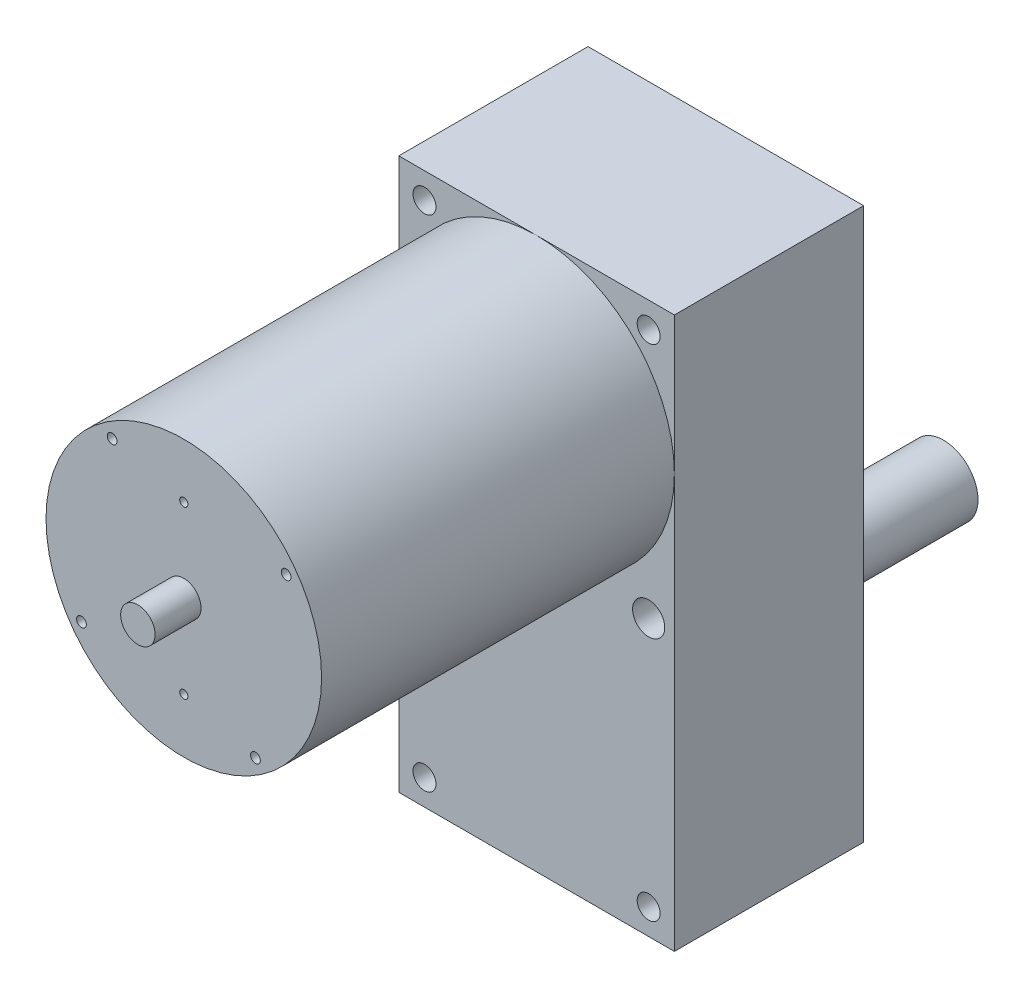
from build123d import *

# Parameters (mm, degrees)
SKETCH1_W                 = 76.2
SKETCH1_H                 = 152.4
SKETCH1_R                 = 3.175
SKETCH1_R_2               = 4.445
BOSS_EXTRUDE1_DEPTH       = 52.324
SKETCH1_3_R               = 23.495
SKETCH1_3_R_2             = 9.525
BOSS_EXTRUDE2_DEPTH       = 4.826
SKETCH1_5_R               = 9.525
SKETCH1_5_R_2             = 3.96875
BOSS_EXTRUDE3_DEPTH       = 60.198
CUT_EXTRUDE1_START        = -26.924
CUT_EXTRUDE1_DEPTH        = 26.924
SKETCH4_R                 = 38.1
BOSS_EXTRUDE4_DEPTH       = 97.536
SKETCH5_R                 = 4.7625
BOSS_EXTRUDE5_DEPTH       = 12.7
F_4_40_TAPPED_HOLE1_D     = 2.2606
F_4_40_TAPPED_HOLE1_DEPTH = 7.6
F_4_40_TAPPED_HOLE1_TIP   = 0.679152758
F_6_32_TAPPED_HOLE1_D     = 2.7051
F_6_32_TAPPED_HOLE1_DEPTH = 9.39
F_6_32_TAPPED_HOLE1_TIP   = 0.81269403


with BuildPart() as part:
    # Sketch1 → Boss-Extrude1 (new body)
    with BuildSketch(Plane.XY):
        Rectangle(SKETCH1_W, SKETCH1_H)
        with Locations((-30.994242086, -69.088)):
            Circle(SKETCH1_R, mode=Mode.SUBTRACT)
        with Locations((-30.988, 0)):
            Circle(SKETCH1_R_2, mode=Mode.SUBTRACT)
        with Locations((30.994242086, -69.088)):
            Circle(SKETCH1_R, mode=Mode.SUBTRACT)
        with Locations((30.988, 0)):
            Circle(SKETCH1_R_2, mode=Mode.SUBTRACT)
        with Locations((-30.988, 69.088)):
            Circle(SKETCH1_R, mode=Mode.SUBTRACT)
        with Locations((30.988, 69.088)):
            Circle(SKETCH1_R, mode=Mode.SUBTRACT)
    extrude(amount=BOSS_EXTRUDE1_DEPTH)

    # Sketch1<3> → Boss-Extrude2 (add)
    # profile 1 of 2: a face of its own
    with BuildSketch(Plane.XY):
        with Locations((0, 38.608)):
            Circle(SKETCH1_3_R)
    # profile 2 of 2: a face of its own
    with BuildSketch(Plane.XY):
        with Locations((0, -38.608)):
            Circle(SKETCH1_3_R)
        with Locations((0, -38.608)):
            Circle(SKETCH1_3_R_2, mode=Mode.SUBTRACT)
    extrude(amount=-BOSS_EXTRUDE2_DEPTH)

    # Sketch1<5> → Boss-Extrude3 (add)
    with BuildSketch(Plane.XY):
        with Locations((0, -38.608)):
            Circle(SKETCH1_5_R)
        with Locations((0, -38.608)):
            Circle(SKETCH1_5_R_2, mode=Mode.SUBTRACT)
    extrude(amount=-BOSS_EXTRUDE3_DEPTH)

    # Sketch2 → Cut-Extrude1 (cut)
    with BuildSketch(Plane(origin=(0, 0, -60.198), x_dir=(-1, 0, 0), z_dir=(0, 0, -1)).offset(CUT_EXTRUDE1_START)):
        with BuildLine():
            Line((8.980256121, -35.433), (4.427938354, -35.433))
            Line((4.427938354, -35.433), (4.427938354, -41.783))
            Line((4.427938354, -41.783), (8.980256121, -41.783))
            ThreePointArc((8.980256121, -41.783), (9.525, -38.608), (8.980256121, -35.433))
        make_face()
    extrude(amount=CUT_EXTRUDE1_DEPTH, mode=Mode.SUBTRACT)

    # Sketch4 → Boss-Extrude4 (add)
    with BuildSketch(Plane.XY.offset(52.324)):
        with Locations((0, 38.1)):
            Circle(SKETCH4_R)
    extrude(amount=BOSS_EXTRUDE4_DEPTH)

    # Sketch5 → Boss-Extrude5 (add)
    with BuildSketch(Plane.XY.offset(149.86)):
        with Locations((0, 38.1)):
            Circle(SKETCH5_R)
    extrude(amount=BOSS_EXTRUDE5_DEPTH)

    # #4-40 Tapped Hole1
    with Locations(Plane.XY.offset(149.86)):
        with Locations((0, 61.1), (0, 15.1)):
            Hole(F_4_40_TAPPED_HOLE1_D / 2, depth=F_4_40_TAPPED_HOLE1_DEPTH)
            with Locations((0, 0, -(F_4_40_TAPPED_HOLE1_DEPTH + F_4_40_TAPPED_HOLE1_TIP / 2))):  # 118° drill point
                Cone(0, F_4_40_TAPPED_HOLE1_D / 2, F_4_40_TAPPED_HOLE1_TIP, mode=Mode.SUBTRACT)

    # #6-32 Tapped Hole1
    with Locations(Plane.XY.offset(149.86)):
        with Locations((28.296788218, 57.913624417), (19.813624417, 9.803211782), (-28.296788218, 18.286375583), (-19.813624417, 66.396788218)):
            Hole(F_6_32_TAPPED_HOLE1_D / 2, depth=F_6_32_TAPPED_HOLE1_DEPTH)
            with Locations((0, 0, -(F_6_32_TAPPED_HOLE1_DEPTH + F_6_32_TAPPED_HOLE1_TIP / 2))):  # 118° drill point
                Cone(0, F_6_32_TAPPED_HOLE1_D / 2, F_6_32_TAPPED_HOLE1_TIP, mode=Mode.SUBTRACT)


solid = part.part
